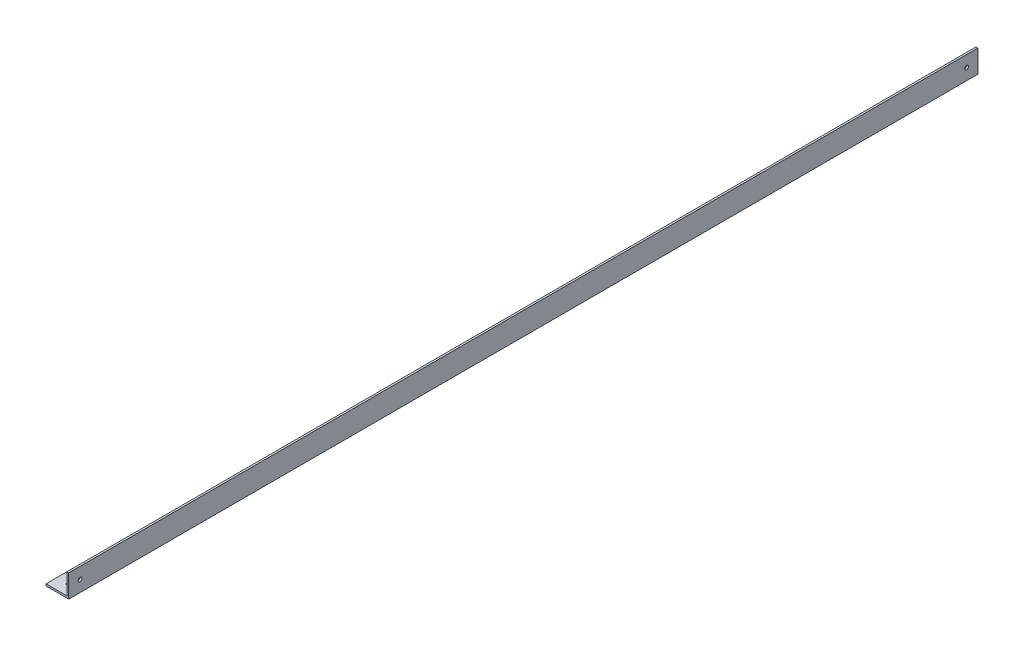
from build123d import *

# Parameters (mm, degrees)
BOSS_EXTRUDE1_DEPTH = 762
SKETCH2_R           = 1.5875
SKETCH2_R_2         = 3.175
CUT_EXTRUDE2_DEPTH  = 2.794
SKETCH4_R           = 1.5875
CUT_EXTRUDE3_DEPTH  = 8.89
SKETCH5_W           = 19.05
SKETCH5_H           = 19.05
CUT_EXTRUDE4_DEPTH  = 764.189696275


with BuildPart() as part:
    # Sketch1 → Boss-Extrude1 (new body)
    with BuildSketch(Plane.XY):
        Polygon((0, 0), (0, 19.05), (1.5875, 19.05), (1.5875, 1.5875), (19.05, 1.5875), (19.05, 0), align=None)
    boss_extrude1 = extrude(amount=-BOSS_EXTRUDE1_DEPTH)

    # Sketch2 → Cut-Extrude2 (cut)
    with BuildSketch(Plane(origin=(0, 1.5875, 0), x_dir=(1, 0, 0), z_dir=(0, 1, 0))):
        with Locations((9.525, 9.525)):
            Circle(SKETCH2_R)
        with Locations((9.525, 752.475)):
            Circle(SKETCH2_R)
        with Locations((9.525, 76.2)):
            Circle(SKETCH2_R_2)
        with Locations((9.525, 703.58)):
            Circle(SKETCH2_R_2)
    cut_extrude2 = extrude(amount=-CUT_EXTRUDE2_DEPTH, mode=Mode.SUBTRACT)

    # Sketch4 → Cut-Extrude3 (cut)
    with BuildSketch(Plane(origin=(1.5875, 0, 0), x_dir=(0, 0, -1), z_dir=(1, 0, 0))):
        with Locations((9.525, 9.525)):
            Circle(SKETCH4_R)
        with Locations((752.475, 9.525)):
            Circle(SKETCH4_R)
    cut_extrude3 = extrude(amount=-CUT_EXTRUDE3_DEPTH, mode=Mode.SUBTRACT)

    # Mirror1: Boss-Extrude1, Cut-Extrude2, Cut-Extrude3 across plane
    add(boss_extrude1.mirror(Plane(origin=(19.05, 0, -762), x_dir=(0, 0, 1), z_dir=(1, 0, 0))))
    add(cut_extrude2.mirror(Plane(origin=(19.05, 0, -762), x_dir=(0, 0, 1), z_dir=(1, 0, 0))), mode=Mode.SUBTRACT)
    add(cut_extrude3.mirror(Plane(origin=(19.05, 0, -762), x_dir=(0, 0, 1), z_dir=(1, 0, 0))), mode=Mode.SUBTRACT)

    # Sketch5 → Cut-Extrude4 (cut, through all)
    with BuildSketch(Plane.XY):
        with Locations((9.525, 9.525)):
            Rectangle(SKETCH5_W, SKETCH5_H)
    extrude(amount=-CUT_EXTRUDE4_DEPTH, mode=Mode.SUBTRACT)


solid = part.part
